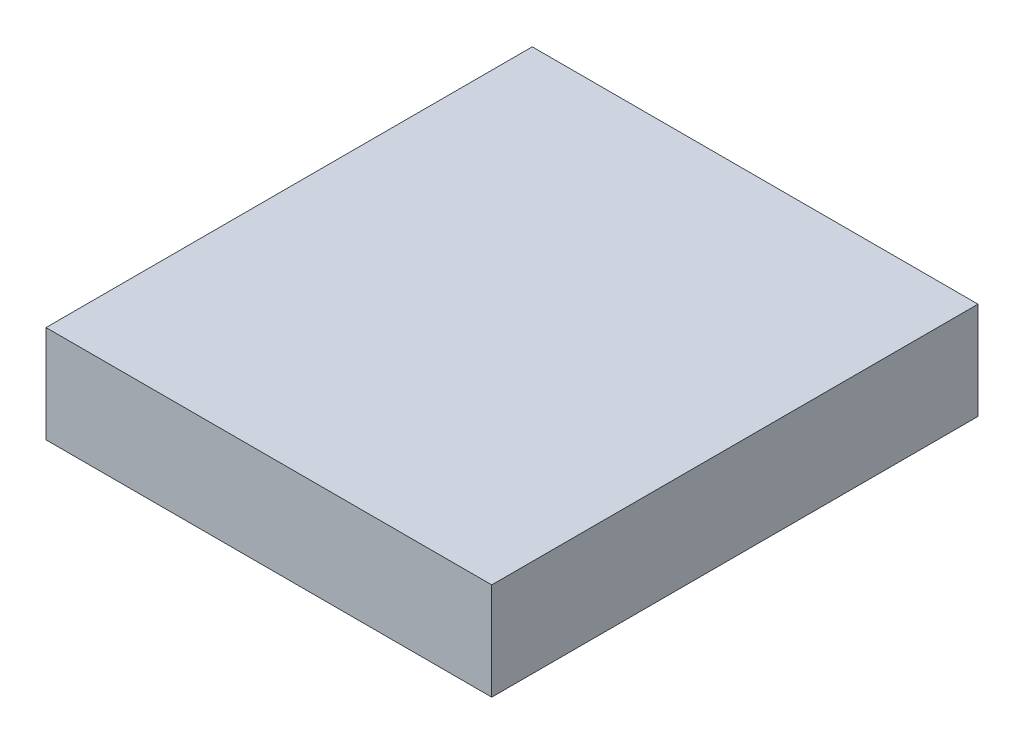
from build123d import *

# Parameters (mm, degrees)
SKETCH1_W           = 110
SKETCH1_H           = 120
BOSS_EXTRUDE1_DEPTH = 24


with BuildPart() as part:
    # Sketch1 → Boss-Extrude1 (new body)
    with BuildSketch(Plane(origin=(0, 0, 0), x_dir=(1, 0, 0), z_dir=(0, 1, 0))):
        Rectangle(SKETCH1_W, SKETCH1_H)
    extrude(amount=BOSS_EXTRUDE1_DEPTH)


solid = part.part
